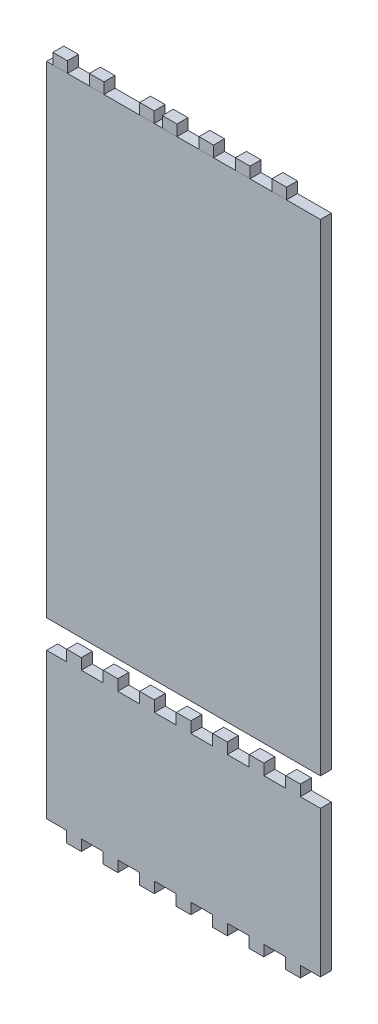
from build123d import *

# Parameters (mm, degrees)
BOSS_EXTRU_1_DEPTH   = 6
ESQUISSE4_W          = 150
ESQUISSE4_H          = 264
BOSS_EXTRU_2_DEPTH   = 6
ESQUISSE5_W          = 8
ESQUISSE5_H          = 6
BOSS_EXTRU_3_DEPTH   = 6
BOSS_EXTRU_3_2_DEPTH = 6
BOSS_EXTRU_3_3_DEPTH = 6
BOSS_EXTRU_3_4_DEPTH = 6
BOSS_EXTRU_3_5_DEPTH = 6
BOSS_EXTRU_3_6_DEPTH = 6
BOSS_EXTRU_3_7_DEPTH = 6


with BuildPart() as part:
    # Esquisse1 → Boss.-Extru.1 (new body)
    with BuildSketch(Plane.XY):
        Polygon((11, -80), (11, -86), (19, -86), (19, -80), (31, -80), (31, -86), (39, -86), (39, -80), (51, -80), (51, -86), (59, -86), (59, -80), (71, -80), (71, -86), (79, -86), (79, -80), (91, -80), (91, -86), (99, -86), (99, -80), (111, -80), (111, -86), (119, -86), (119, -80), (131, -80), (131, -86), (139, -86), (139, -80), (150, -80), (150, 0), (139, 0), (139, 6), (131, 6), (131, 0), (119, 0), (119, 6), (111, 6), (111, 0), (99, 0), (99, 6), (91, 6), (91, 0), (79, 0), (79, 6), (71, 6), (71, 0), (59, 0), (59, 6), (51, 6), (51, 0), (39, 0), (39, 6), (31, 6), (31, 0), (19, 0), (19, 6), (11, 6), (11, 0), (0, 0), (0, -80), align=None)
    extrude(amount=BOSS_EXTRU_1_DEPTH)


with BuildPart() as body_2:
    # Esquisse4 → Boss.-Extru.2 (new body)
    with BuildSketch(Plane.XY.offset(6)):
        with Locations((75, 147.375370895)):
            Rectangle(ESQUISSE4_W, ESQUISSE4_H)
    extrude(amount=-BOSS_EXTRU_2_DEPTH)


with BuildPart() as body_3:
    # Esquisse5 → Boss.-Extru.3 (new body)
    with BuildSketch(Plane.XY.offset(6)):
        with Locations((7.43305916, 282.375370895)):
            Rectangle(ESQUISSE5_W, ESQUISSE5_H)
    extrude(amount=-BOSS_EXTRU_3_DEPTH)


with BuildPart() as body_4:
    # Esquisse5 → Boss.-Extru.3 2 (new body)
    with BuildSketch(Plane.XY.offset(6)):
        with Locations((27.43305916, 282.375370895)):
            Rectangle(ESQUISSE5_W, ESQUISSE5_H)
    extrude(amount=-BOSS_EXTRU_3_2_DEPTH)


with BuildPart() as body_5:
    # Esquisse5 → Boss.-Extru.3 3 (new body)
    with BuildSketch(Plane.XY.offset(6)):
        with Locations((54.962850026, 282.375370895)):
            Rectangle(ESQUISSE5_W, ESQUISSE5_H)
    extrude(amount=-BOSS_EXTRU_3_3_DEPTH)


with BuildPart() as body_6:
    # Esquisse5 → Boss.-Extru.3 4 (new body)
    with BuildSketch(Plane.XY.offset(6)):
        with Locations((67.43305916, 282.375370895)):
            Rectangle(ESQUISSE5_W, ESQUISSE5_H)
    extrude(amount=-BOSS_EXTRU_3_4_DEPTH)


with BuildPart() as body_7:
    # Esquisse5 → Boss.-Extru.3 5 (new body)
    with BuildSketch(Plane.XY.offset(6)):
        with Locations((87.43305916, 282.375370895)):
            Rectangle(ESQUISSE5_W, ESQUISSE5_H)
    extrude(amount=-BOSS_EXTRU_3_5_DEPTH)


with BuildPart() as body_8:
    # Esquisse5 → Boss.-Extru.3 6 (new body)
    with BuildSketch(Plane.XY.offset(6)):
        with Locations((107.43305916, 282.375370895)):
            Rectangle(ESQUISSE5_W, ESQUISSE5_H)
    extrude(amount=-BOSS_EXTRU_3_6_DEPTH)


with BuildPart() as body_9:
    # Esquisse5 → Boss.-Extru.3 7 (new body)
    with BuildSketch(Plane.XY.offset(6)):
        with Locations((127.43305916, 282.375370895)):
            Rectangle(ESQUISSE5_W, ESQUISSE5_H)
    extrude(amount=-BOSS_EXTRU_3_7_DEPTH)


solid = Compound([part.part, body_2.part, body_3.part, body_4.part, body_5.part, body_6.part, body_7.part, body_8.part, body_9.part])
